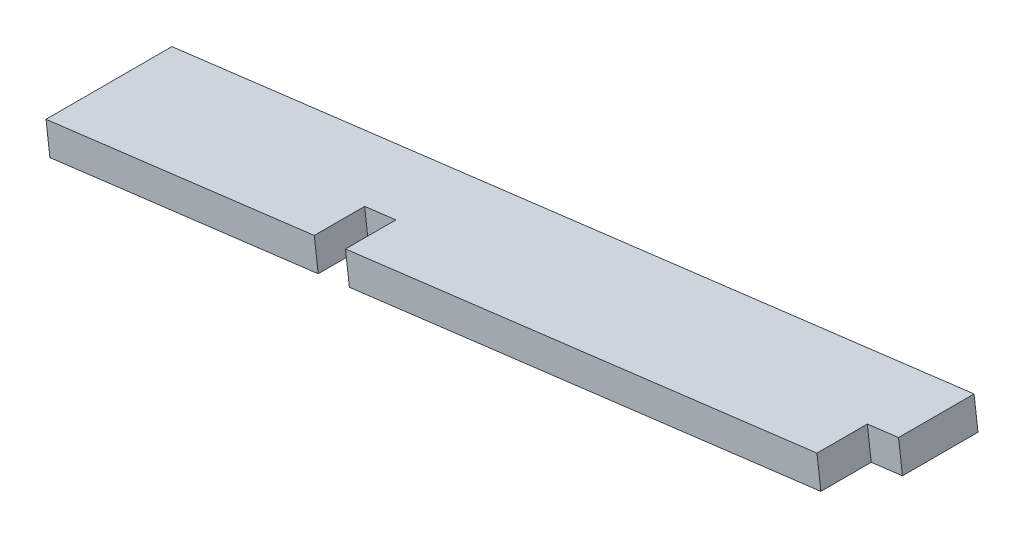
from build123d import *

# Parameters (mm, degrees)
BOSS_EXTRUDE1_DEPTH = 3.175


with BuildPart() as part:
    # Sketch1 → Boss-Extrude1 (new body)
    with BuildSketch(Plane(origin=(2.493742196, -19.944478146, 0), x_dir=(0.9922736974441427, 0.12406816417006415, 0), z_dir=(-0.12406816417006414, 0.9922736974441426, 0))):
        Polygon((374.797983109, 649.396489798), (293.252534485, 649.396489798), (293.252534485, 636.696489798), (320.52476033, 636.696489798), (320.52476033, 641.776487594), (323.69976033, 641.776487594), (323.695027309, 636.696489798), (371.62298639, 636.696489798), (371.62298639, 641.776489798), (374.79798639, 641.776489798), align=None)
    extrude(amount=BOSS_EXTRUDE1_DEPTH)


solid = part.part
